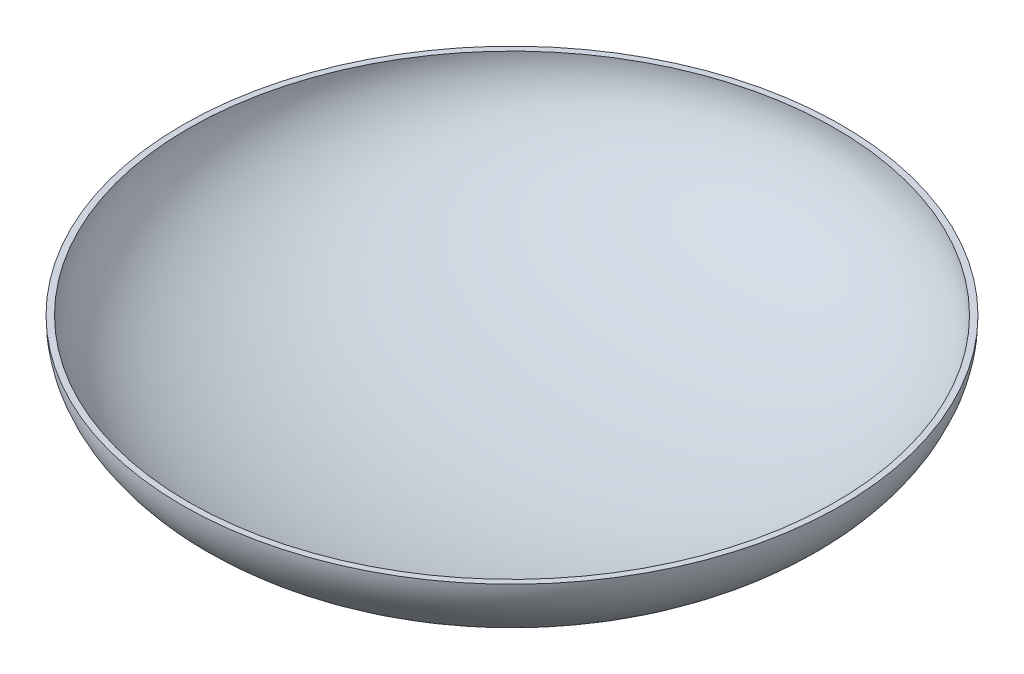
from build123d import *


with BuildPart() as part:
    # Sketch1 → Revolve1 (revolve)
    with BuildSketch(Plane.XY):
        with BuildLine():
            Line((-137.16, -61.872427598), (-139.7, -61.872427598))
            add(Edge.make_bspline(
                [(-139.7, -61.872427598), (-139.7, -120.292427598), (0, -120.292427598)],
                knots=[3.141592654, 3.141592654, 3.141592654, 4.71238898, 4.71238898, 4.71238898], degree=2, weights=[1, 0.707106781, 1]))
            Line((0, -120.292427598), (0, -117.752427598))
            add(Edge.make_bspline(
                [(-137.16, -61.872427598), (-137.16, -117.752427598), (0, -117.752427598)],
                knots=[3.141592654, 3.141592654, 3.141592654, 4.71238898, 4.71238898, 4.71238898], degree=2, weights=[1, 0.707106781, 1]))
        make_face()
    revolve(axis=Axis((0, -117.752427598, 0), (0, -1, 0)))


solid = part.part
